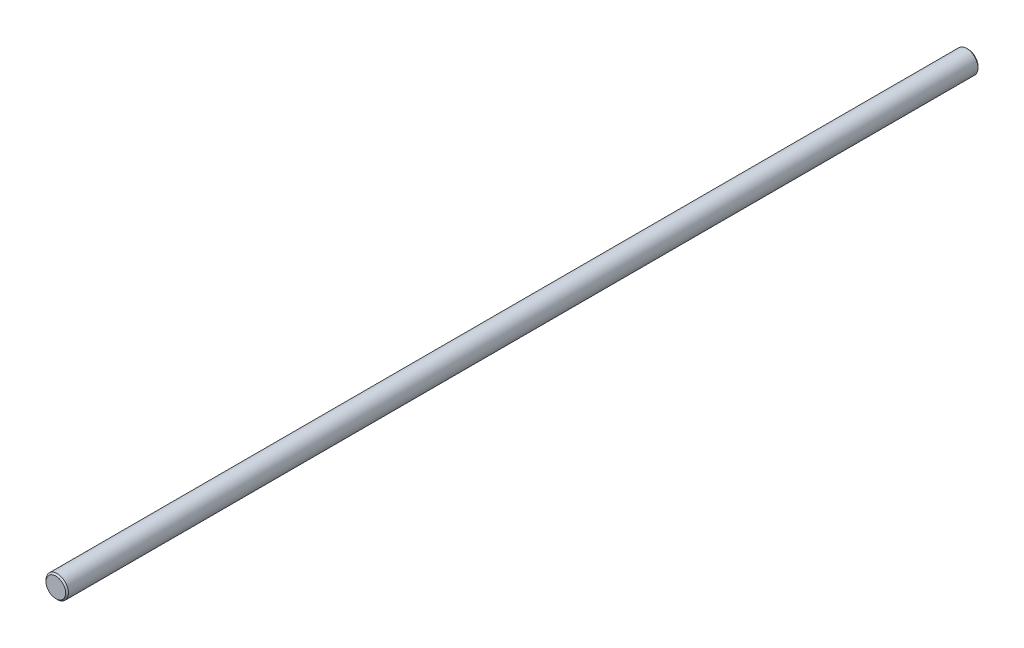
from build123d import *

# Parameters (mm, degrees)
SKETCH_1_R      = 8
EXTRUDE_1_DEPTH = 650
CHAMFER_1_SIZE  = 1


with BuildPart() as part:
    # Эскиз1 → Бобышка-Вытянуть1 (new body)
    with BuildSketch(Plane.XY):
        Circle(SKETCH_1_R)
    extrude(amount=EXTRUDE_1_DEPTH)

    # Фаска1
    chamfer_1_edges = [part.edges().sort_by_distance(p)[0] for p in [
        (-8, 0, 0),
        (-8, 0, 650),
    ]]
    chamfer(chamfer_1_edges, length=CHAMFER_1_SIZE)


solid = part.part
